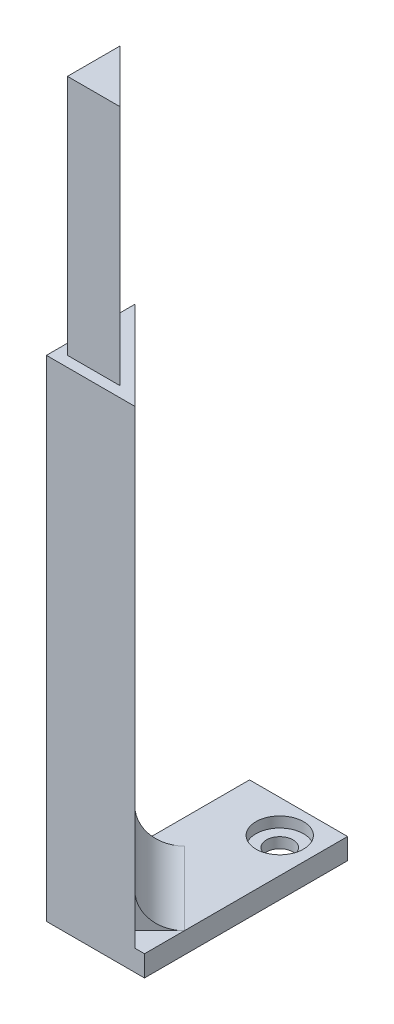
from build123d import *

# Parameters (mm, degrees)
BOSS_EXTRUDE3_DEPTH = 320
SKETCH7_W           = 15
SKETCH7_H           = 111
CUT_EXTRUDE3_DEPTH  = 321.702354216
BOSS_EXTRUDE5_DEPTH = 140
SKETCH4_R           = 3.8
BOSS_EXTRUDE4_DEPTH = 6
BOSS_EXTRUDE6_DEPTH = 10
CUT_EXTRUDE4_DEPTH  = 220.0148158
SKETCH11_R          = 6.8
CUT_EXTRUDE5_DEPTH  = 3


with BuildPart() as part:
    # Sketch1 → Boss-Extrude3 (new body)
    with BuildSketch(Plane(origin=(0, 0, 0), x_dir=(1, 0, 0), z_dir=(0, 1, 0))):
        Polygon((0, 0), (0, 15), (15, 0), align=None)
    extrude(amount=BOSS_EXTRUDE3_DEPTH)

    # Sketch7 → Cut-Extrude3 (cut, through all)
    with BuildSketch(Plane.XY):
        with Locations((7.5, 264.5)):
            Rectangle(SKETCH7_W, SKETCH7_H)
    extrude(amount=-CUT_EXTRUDE3_DEPTH, mode=Mode.SUBTRACT)

    # Sketch8 → Boss-Extrude5 (add)
    with BuildSketch(Plane.XZ):
        Polygon((-3, -22.242640687), (-3, 3), (22.242640687, 3), align=None)
    extrude(amount=-BOSS_EXTRUDE5_DEPTH)

    # Sketch4 → Boss-Extrude4 (add)
    with BuildSketch(Plane.XZ):
        Polygon((0, -55), (25, -55), (25, 3), (22.242640687, 3), (-3, -22.242640687), (-3, -55), align=None)
        with Locations(Location((15.04, -45.59, 0), (0, 0, 270))):
            Circle(SKETCH4_R, mode=Mode.SUBTRACT)
    extrude(amount=-BOSS_EXTRUDE4_DEPTH)

    # Sketch9 → Boss-Extrude6 (add)
    with BuildSketch(Plane(origin=(0, 6, 0), x_dir=(1, 0, 0), z_dir=(0, 1, 0))):
        Polygon((-3, 22.242640687), (4.071067812, 29.313708499), (25, 8.384776311), (17.928932188, 1.313708499), align=None)
    extrude(amount=BOSS_EXTRUDE6_DEPTH)

    # Sketch10 → Cut-Extrude4 (cut, through all)
    with BuildSketch(Plane(origin=(8.307611845, 0, 8.307611845), x_dir=(0.7071067811865479, 0, -0.7071067811865471), z_dir=(0.7071067811865471, 0, 0.7071067811865479))):
        with BuildLine():
            Line((13.606601718, 16), (23.606601718, 16))
            Line((23.606601718, 16), (23.606601718, 6))
            ThreePointArc((23.606601718, 6), (16.535533906, 8.928932188), (13.606601718, 16))
        make_face()
    extrude(amount=-CUT_EXTRUDE4_DEPTH, mode=Mode.SUBTRACT)

    # Sketch11 → Cut-Extrude5 (cut)
    with BuildSketch(Plane(origin=(0, 6, 0), x_dir=(1, 0, 0), z_dir=(0, 1, 0))):
        with Locations(Location((15.04, 45.59, 0), (0, 0, 270))):
            Circle(SKETCH11_R)
    extrude(amount=-CUT_EXTRUDE5_DEPTH, mode=Mode.SUBTRACT)


solid = part.part
